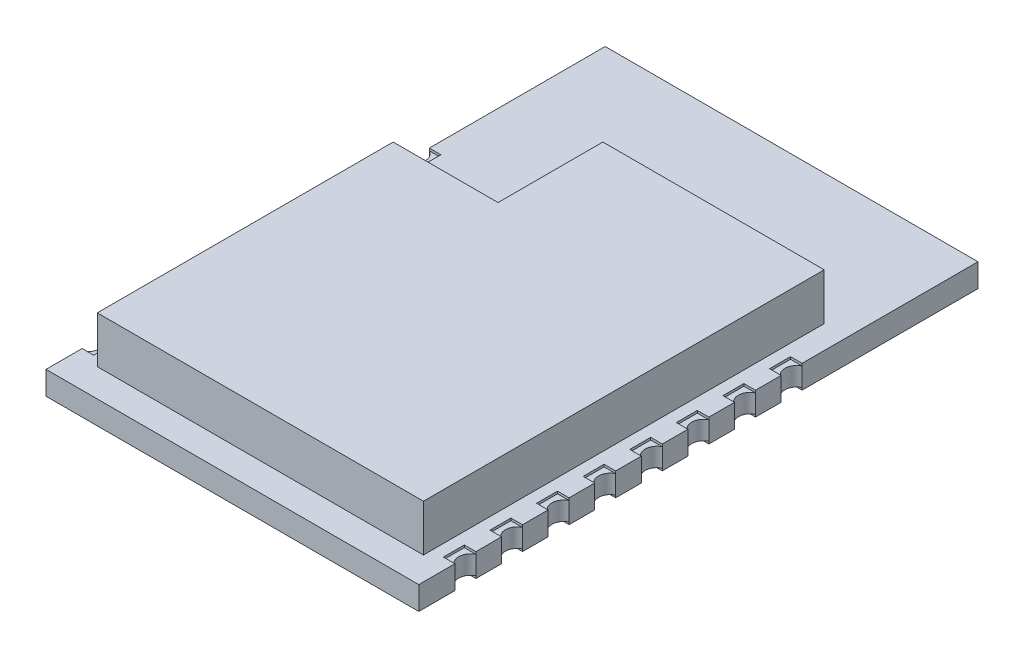
from build123d import *

# Parameters (mm, degrees)
SKETCH_1_W          = 16
SKETCH_1_H          = 24
EXTRUDE_1_DEPTH     = 1
SKETCH_2_W          = 0.497014283
SKETCH_2_H          = 0.9
SKETCH_2_W_2        = 0.5
CUT_EXTRUDE_1_DEPTH = 0.1
SKETCH_3_W          = 1
SKETCH_3_H          = 0.9
CUT_EXTRUDE_2_DEPTH = 0.1
SKETCH_8_W          = 4.7
SKETCH_8_H          = 4.7
CUT_EXTRUDE_3_DEPTH = 0.1
SKETCH_12_R         = 0.2
CUT_EXTRUDE_4_DEPTH = 0.1
SKETCH_13_W         = 4.7
SKETCH_13_H         = 4.7
EXTRUDE_2_DEPTH     = 0.5
SKETCH_15_W         = 4.7
SKETCH_15_H         = 4.7
CUT_EXTRUDE_5_DEPTH = 0.1
SKETCH_16_R         = 0.2
CUT_EXTRUDE_6_DEPTH = 0.25
EXTRUDE_4_DEPTH     = 2
CUT_EXTRUDE_7_DEPTH = 2


with BuildPart() as part:
    # 草圖1 → 填料-伸長1 (new body)
    with BuildSketch(Plane(origin=(0, 0, 0), x_dir=(1, 0, 0), z_dir=(0, 1, 0))):
        Rectangle(SKETCH_1_W, SKETCH_1_H)
    extrude(amount=EXTRUDE_1_DEPTH)

    # 草圖2 → 除料-伸長1 (cut)
    with BuildSketch(Plane(origin=(0, 1, 0), x_dir=(1, 0, 0), z_dir=(0, 1, 0))):
        with Locations((-7.751492859, 1.999997771)):
            Rectangle(SKETCH_2_W, SKETCH_2_H)
        with Locations((-7.751492859, -2.229e-06)):
            Rectangle(SKETCH_2_W, SKETCH_2_H)
        with Locations((-7.751492859, -2.000002229)):
            Rectangle(SKETCH_2_W, SKETCH_2_H)
        with Locations((-7.751492859, -4.000002229)):
            Rectangle(SKETCH_2_W, SKETCH_2_H)
        with Locations((-7.751492859, -6.000002229)):
            Rectangle(SKETCH_2_W, SKETCH_2_H)
        with Locations((-7.751492859, -8.000002229)):
            Rectangle(SKETCH_2_W, SKETCH_2_H)
        with Locations((-7.751492859, -10.000002229)):
            Rectangle(SKETCH_2_W, SKETCH_2_H)
        with Locations((7.751492859, -10.000002229)):
            Rectangle(SKETCH_2_W, SKETCH_2_H)
        with Locations((7.751492859, -8.000002229)):
            Rectangle(SKETCH_2_W, SKETCH_2_H)
        with Locations((7.751492859, -6.000002229)):
            Rectangle(SKETCH_2_W, SKETCH_2_H)
        with Locations((7.751492859, -4.000002229)):
            Rectangle(SKETCH_2_W, SKETCH_2_H)
        with Locations((7.751492859, -2.000002229)):
            Rectangle(SKETCH_2_W, SKETCH_2_H)
        with Locations((7.751492859, -2.229e-06)):
            Rectangle(SKETCH_2_W, SKETCH_2_H)
        with Locations((7.751492859, 3.999997771)):
            Rectangle(SKETCH_2_W, SKETCH_2_H)
        with Locations((7.751492859, 1.999997771)):
            Rectangle(SKETCH_2_W, SKETCH_2_H)
        with Locations((-7.752985717, 3.999997771)):
            Rectangle(SKETCH_2_W_2, SKETCH_2_H)
    extrude(amount=-CUT_EXTRUDE_1_DEPTH, mode=Mode.SUBTRACT)

    # 草圖3 → 除料-伸長2 (cut)
    with BuildSketch(Plane.XZ):
        with Locations((7.5, 8)):
            Rectangle(SKETCH_3_W, SKETCH_3_H)
        with Locations((7.5, 10)):
            Rectangle(SKETCH_3_W, SKETCH_3_H)
        with Locations((7.5, 6)):
            Rectangle(SKETCH_3_W, SKETCH_3_H)
        with Locations((7.5, 4)):
            Rectangle(SKETCH_3_W, SKETCH_3_H)
        with Locations((7.5, 2)):
            Rectangle(SKETCH_3_W, SKETCH_3_H)
        with Locations((7.5, 0)):
            Rectangle(SKETCH_3_W, SKETCH_3_H)
        with Locations((7.5, -2)):
            Rectangle(SKETCH_3_W, SKETCH_3_H)
        with Locations((7.5, -4)):
            Rectangle(SKETCH_3_W, SKETCH_3_H)
        with Locations((-7.5, 10)):
            Rectangle(SKETCH_3_W, SKETCH_3_H)
        with Locations((-7.5, -4)):
            Rectangle(SKETCH_3_W, SKETCH_3_H)
        with Locations((-7.5, -2)):
            Rectangle(SKETCH_3_W, SKETCH_3_H)
        with Locations((-7.5, 0)):
            Rectangle(SKETCH_3_W, SKETCH_3_H)
        with Locations((-7.5, 2)):
            Rectangle(SKETCH_3_W, SKETCH_3_H)
        with Locations((-7.5, 4)):
            Rectangle(SKETCH_3_W, SKETCH_3_H)
        with Locations((-7.5, 6)):
            Rectangle(SKETCH_3_W, SKETCH_3_H)
        with Locations((-7.5, 8)):
            Rectangle(SKETCH_3_W, SKETCH_3_H)
    extrude(amount=-CUT_EXTRUDE_2_DEPTH, mode=Mode.SUBTRACT)

    # 草圖8 → 除料-伸長3 (cut)
    with BuildSketch(Plane(origin=(0, 1, 0), x_dir=(1, 0, 0), z_dir=(0, 1, 0))):
        with Locations((1.35, -1.75)):
            Rectangle(SKETCH_8_W, SKETCH_8_H)
    extrude(amount=-CUT_EXTRUDE_3_DEPTH, mode=Mode.SUBTRACT)

    # 草圖12 → 除料-伸長4 (cut)
    with BuildSketch(Plane(origin=(0, 0.9, 0), x_dir=(1, 0, 0), z_dir=(0, 1, 0))):
        with Locations(Location((-0.51, -3.65, 0), (0, 0, 270))):
            Circle(SKETCH_12_R)
        with Locations(Location((0.42, -3.65, 0), (0, 0, 270))):
            Circle(SKETCH_12_R)
        with Locations(Location((1.35, -3.65, 0), (0, 0, 270))):
            Circle(SKETCH_12_R)
        with Locations(Location((2.28, -3.65, 0), (0, 0, 270))):
            Circle(SKETCH_12_R)
        with Locations(Location((3.21, -3.65, 0), (0, 0, 270))):
            Circle(SKETCH_12_R)
        with Locations(Location((-0.51, -2.72, 0), (0, 0, 270))):
            Circle(SKETCH_12_R)
        with Locations(Location((0.42, -2.72, 0), (0, 0, 270))):
            Circle(SKETCH_12_R)
        with Locations(Location((1.35, -2.72, 0), (0, 0, 270))):
            Circle(SKETCH_12_R)
        with Locations(Location((2.28, -2.72, 0), (0, 0, 270))):
            Circle(SKETCH_12_R)
        with Locations(Location((3.21, -2.72, 0), (0, 0, 270))):
            Circle(SKETCH_12_R)
        with Locations(Location((-0.51, -1.79, 0), (0, 0, 270))):
            Circle(SKETCH_12_R)
        with Locations(Location((0.42, -1.79, 0), (0, 0, 270))):
            Circle(SKETCH_12_R)
        with Locations(Location((1.35, -1.79, 0), (0, 0, 270))):
            Circle(SKETCH_12_R)
        with Locations(Location((2.28, -1.79, 0), (0, 0, 270))):
            Circle(SKETCH_12_R)
        with Locations(Location((3.21, -1.79, 0), (0, 0, 270))):
            Circle(SKETCH_12_R)
        with Locations(Location((-0.51, -0.86, 0), (0, 0, 270))):
            Circle(SKETCH_12_R)
        with Locations(Location((0.42, -0.86, 0), (0, 0, 270))):
            Circle(SKETCH_12_R)
        with Locations(Location((1.35, -0.86, 0), (0, 0, 270))):
            Circle(SKETCH_12_R)
        with Locations(Location((2.28, -0.86, 0), (0, 0, 270))):
            Circle(SKETCH_12_R)
        with Locations(Location((3.21, -0.86, 0), (0, 0, 270))):
            Circle(SKETCH_12_R)
        with Locations(Location((-0.51, 0.07, 0), (0, 0, 270))):
            Circle(SKETCH_12_R)
        with Locations(Location((0.42, 0.07, 0), (0, 0, 270))):
            Circle(SKETCH_12_R)
        with Locations(Location((1.35, 0.07, 0), (0, 0, 270))):
            Circle(SKETCH_12_R)
        with Locations(Location((2.28, 0.07, 0), (0, 0, 270))):
            Circle(SKETCH_12_R)
        with Locations(Location((3.21, 0.07, 0), (0, 0, 270))):
            Circle(SKETCH_12_R)
    extrude(amount=-CUT_EXTRUDE_4_DEPTH, mode=Mode.SUBTRACT)

    # 草圖13 → 填料-伸長2 (add)
    with BuildSketch(Plane(origin=(0, 1, 0), x_dir=(1, 0, 0), z_dir=(0, 1, 0))):
        with Locations((1.35, -1.75)):
            Rectangle(SKETCH_13_W, SKETCH_13_H)
    extrude(amount=-EXTRUDE_2_DEPTH)

    # 草圖15 → 除料-伸長5 (cut)
    with BuildSketch(Plane.XZ):
        with Locations((-1.35, 1.75)):
            Rectangle(SKETCH_15_W, SKETCH_15_H)
    extrude(amount=-CUT_EXTRUDE_5_DEPTH, mode=Mode.SUBTRACT)

    # 草圖16 → 除料-伸長6 (cut)
    with BuildSketch(Plane.XZ):
        with Locations(Location((0.51, 3.61, 0), (0, 0, 270))):
            Circle(SKETCH_16_R)
        with Locations(Location((-0.42, 3.61, 0), (0, 0, 270))):
            Circle(SKETCH_16_R)
        with Locations(Location((-1.35, 3.61, 0), (0, 0, 270))):
            Circle(SKETCH_16_R)
        with Locations(Location((-2.28, 3.61, 0), (0, 0, 270))):
            Circle(SKETCH_16_R)
        with Locations(Location((-3.21, 3.61, 0), (0, 0, 270))):
            Circle(SKETCH_16_R)
        with Locations(Location((-3.21, 2.68, 0), (0, 0, 270))):
            Circle(SKETCH_16_R)
        with Locations(Location((-2.28, 2.68, 0), (0, 0, 270))):
            Circle(SKETCH_16_R)
        with Locations(Location((-1.35, 2.68, 0), (0, 0, 270))):
            Circle(SKETCH_16_R)
        with Locations(Location((-0.42, 2.68, 0), (0, 0, 270))):
            Circle(SKETCH_16_R)
        with Locations(Location((0.51, 2.68, 0), (0, 0, 270))):
            Circle(SKETCH_16_R)
        with Locations(Location((-3.21, 1.75, 0), (0, 0, 270))):
            Circle(SKETCH_16_R)
        with Locations(Location((-2.28, 1.75, 0), (0, 0, 270))):
            Circle(SKETCH_16_R)
        with Locations(Location((-1.35, 1.75, 0), (0, 0, 270))):
            Circle(SKETCH_16_R)
        with Locations(Location((-0.42, 1.75, 0), (0, 0, 270))):
            Circle(SKETCH_16_R)
        with Locations(Location((0.51, 1.75, 0), (0, 0, 270))):
            Circle(SKETCH_16_R)
        with Locations(Location((-3.21, 0.82, 0), (0, 0, 270))):
            Circle(SKETCH_16_R)
        with Locations(Location((-2.28, 0.82, 0), (0, 0, 270))):
            Circle(SKETCH_16_R)
        with Locations(Location((-1.35, 0.82, 0), (0, 0, 270))):
            Circle(SKETCH_16_R)
        with Locations(Location((-0.42, 0.82, 0), (0, 0, 270))):
            Circle(SKETCH_16_R)
        with Locations(Location((0.51, 0.82, 0), (0, 0, 270))):
            Circle(SKETCH_16_R)
        with Locations(Location((-3.21, -0.11, 0), (0, 0, 270))):
            Circle(SKETCH_16_R)
        with Locations(Location((-2.28, -0.11, 0), (0, 0, 270))):
            Circle(SKETCH_16_R)
        with Locations(Location((-1.35, -0.11, 0), (0, 0, 270))):
            Circle(SKETCH_16_R)
        with Locations(Location((-0.42, -0.11, 0), (0, 0, 270))):
            Circle(SKETCH_16_R)
        with Locations(Location((0.51, -0.11, 0), (0, 0, 270))):
            Circle(SKETCH_16_R)
    extrude(amount=-CUT_EXTRUDE_6_DEPTH, mode=Mode.SUBTRACT)

    # 草圖17 → 填料-伸長4 (add)
    with BuildSketch(Plane(origin=(0, 1, 0), x_dir=(1, 0, 0), z_dir=(0, 1, 0))):
        Polygon((-2.5, 6.4), (7, 6.4), (7, -10.8), (-7, -10.8), (-7, 1.4), (-7, 1.9), (-2.5, 1.9), align=None)
    extrude(amount=EXTRUDE_4_DEPTH)

    # 草圖18 → 除料-伸長7 (cut)
    with BuildSketch(Plane(origin=(0, 1, 0), x_dir=(1, 0, 0), z_dir=(0, 1, 0))):
        with BuildLine():
            Line((-8, 4.449997771), (-8, 3.549997771))
            ThreePointArc((-8, 3.549997771), (-7.717944947, 3.999997771), (-8, 4.449997771))
        make_face()
        with BuildLine():
            Line((-8, 2.449997771), (-8, 1.549997771))
            ThreePointArc((-8, 1.549997771), (-7.717944947, 1.999997771), (-8, 2.449997771))
        make_face()
        with BuildLine():
            Line((-8, 0.449997771), (-8, -0.450002229))
            ThreePointArc((-8, -0.450002229), (-7.717944947, -2.229e-06), (-8, 0.449997771))
        make_face()
        with BuildLine():
            Line((-8, -1.550002229), (-8, -2.450002229))
            ThreePointArc((-8, -2.450002229), (-7.717944947, -2.000002229), (-8, -1.550002229))
        make_face()
        with BuildLine():
            Line((-8, -3.550002229), (-8, -4.450002229))
            ThreePointArc((-8, -4.450002229), (-7.717944947, -4.000002229), (-8, -3.550002229))
        make_face()
        with BuildLine():
            Line((-8, -5.550002229), (-8, -6.450002229))
            ThreePointArc((-8, -6.450002229), (-7.717944947, -6.000002229), (-8, -5.550002229))
        make_face()
        with BuildLine():
            Line((-8, -7.550002229), (-8, -8.450002229))
            ThreePointArc((-8, -8.450002229), (-7.717944947, -8.000002229), (-8, -7.550002229))
        make_face()
        with BuildLine():
            Line((-8, -9.550002229), (-8, -10.450002229))
            ThreePointArc((-8, -10.450002229), (-7.717944947, -10.000002229), (-8, -9.550002229))
        make_face()
        with BuildLine():
            Line((8, 4.449997771), (8, 3.549997771))
            ThreePointArc((8, 3.549997771), (7.717944947, 3.999997771), (8, 4.449997771))
        make_face()
        with BuildLine():
            Line((8, 2.449997771), (8, 1.549997771))
            ThreePointArc((8, 1.549997771), (7.717944947, 1.999997771), (8, 2.449997771))
        make_face()
        with BuildLine():
            Line((8, 0.449997771), (8, -0.450002229))
            ThreePointArc((8, -0.450002229), (7.717944947, -2.229e-06), (8, 0.449997771))
        make_face()
        with BuildLine():
            Line((8, -1.550002229), (8, -2.450002229))
            ThreePointArc((8, -2.450002229), (7.717944947, -2.000002229), (8, -1.550002229))
        make_face()
        with BuildLine():
            Line((8, -3.550002229), (8, -4.450002229))
            ThreePointArc((8, -4.450002229), (7.717944947, -4.000002229), (8, -3.550002229))
        make_face()
        with BuildLine():
            Line((8, -5.550002229), (8, -6.450002229))
            ThreePointArc((8, -6.450002229), (7.717944947, -6.000002229), (8, -5.550002229))
        make_face()
        with BuildLine():
            Line((8, -7.550002229), (8, -8.450002229))
            ThreePointArc((8, -8.450002229), (7.717944947, -8.000002229), (8, -7.550002229))
        make_face()
        with BuildLine():
            Line((8, -9.550002229), (8, -10.450002229))
            ThreePointArc((8, -10.450002229), (7.717944947, -10.000002229), (8, -9.550002229))
        make_face()
    extrude(amount=-CUT_EXTRUDE_7_DEPTH, mode=Mode.SUBTRACT)


solid = part.part
